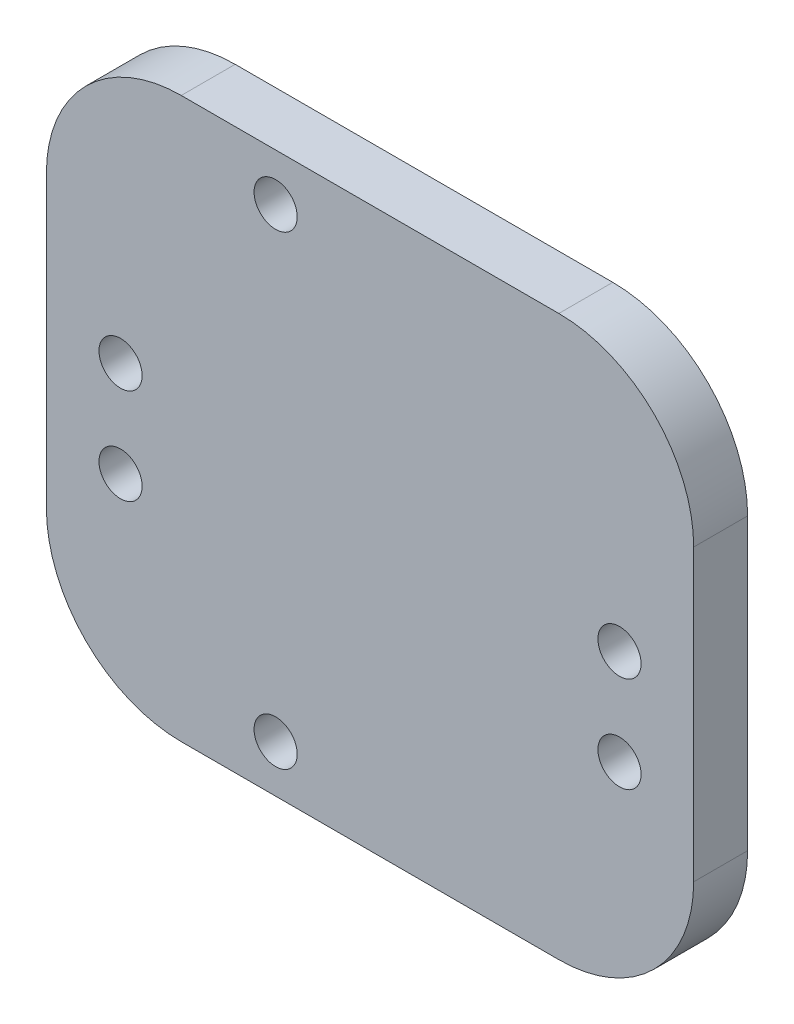
from build123d import *

# Parameters (mm, degrees)
BOSS_EXTRUDE1_DEPTH = 4
CUT_EXTRUDE1_REACH  = 33.978
SKETCH2_R           = 1.6


with BuildPart() as part:
    # Sketch1 → Boss-Extrude1 (new body)
    with BuildSketch(Plane.XY):
        with BuildLine():
            Line((-14, 20.75), (14, 20.75))
            ThreePointArc((14, 20.75), (21.071067812, 17.821067812), (24, 10.75))
            Line((24, 10.75), (24, -10.75))
            ThreePointArc((24, -10.75), (21.071067812, -17.821067812), (14, -20.75))
            Line((14, -20.75), (-14, -20.75))
            ThreePointArc((-14, -20.75), (-21.071067812, -17.821067812), (-24, -10.75))
            Line((-24, -10.75), (-24, 10.75))
            ThreePointArc((-24, 10.75), (-21.071067812, 17.821067812), (-14, 20.75))
        make_face()
    extrude(amount=BOSS_EXTRUDE1_DEPTH)

    # Sketch2 → Cut-Extrude1 (cut, up to next)
    with BuildSketch(Plane.XY, mode=Mode.PRIVATE) as cut_extrude1_sk1:
        with Locations((-7, -17.25)):
            Circle(SKETCH2_R)
    cut_extrude1_tool1 = extrude(cut_extrude1_sk1.sketch, amount=CUT_EXTRUDE1_REACH, mode=Mode.PRIVATE) & part.part
    # Sketch2 → Cut-Extrude1 (cut, up to next)
    with BuildSketch(Plane.XY, mode=Mode.PRIVATE) as cut_extrude1_sk2:
        with Locations((-7, 17.25)):
            Circle(SKETCH2_R)
    cut_extrude1_tool2 = extrude(cut_extrude1_sk2.sketch, amount=CUT_EXTRUDE1_REACH, mode=Mode.PRIVATE) & part.part
    # Sketch2 → Cut-Extrude1 (cut, up to next)
    with BuildSketch(Plane.XY, mode=Mode.PRIVATE) as cut_extrude1_sk3:
        with Locations((18.5, -5.8)):
            Circle(SKETCH2_R)
    cut_extrude1_tool3 = extrude(cut_extrude1_sk3.sketch, amount=CUT_EXTRUDE1_REACH, mode=Mode.PRIVATE) & part.part
    # Sketch2 → Cut-Extrude1 (cut, up to next)
    with BuildSketch(Plane.XY, mode=Mode.PRIVATE) as cut_extrude1_sk4:
        with Locations((18.5, 1.3)):
            Circle(SKETCH2_R)
    cut_extrude1_tool4 = extrude(cut_extrude1_sk4.sketch, amount=CUT_EXTRUDE1_REACH, mode=Mode.PRIVATE) & part.part
    # Sketch2 → Cut-Extrude1 (cut, up to next)
    with BuildSketch(Plane.XY, mode=Mode.PRIVATE) as cut_extrude1_sk5:
        with Locations((-18.5, -5.8)):
            Circle(SKETCH2_R)
    cut_extrude1_tool5 = extrude(cut_extrude1_sk5.sketch, amount=CUT_EXTRUDE1_REACH, mode=Mode.PRIVATE) & part.part
    # Sketch2 → Cut-Extrude1 (cut, up to next)
    with BuildSketch(Plane.XY, mode=Mode.PRIVATE) as cut_extrude1_sk6:
        with Locations((-18.5, 1.3)):
            Circle(SKETCH2_R)
    cut_extrude1_tool6 = extrude(cut_extrude1_sk6.sketch, amount=CUT_EXTRUDE1_REACH, mode=Mode.PRIVATE) & part.part
    add(cut_extrude1_tool1.solids().sort_by_distance((-7, -17.25, 0))[0], mode=Mode.SUBTRACT)
    add(cut_extrude1_tool2.solids().sort_by_distance((-7, 17.25, 0))[0], mode=Mode.SUBTRACT)
    add(cut_extrude1_tool3.solids().sort_by_distance((18.5, -5.8, 0))[0], mode=Mode.SUBTRACT)
    add(cut_extrude1_tool4.solids().sort_by_distance((18.5, 1.3, 0))[0], mode=Mode.SUBTRACT)
    add(cut_extrude1_tool5.solids().sort_by_distance((-18.5, -5.8, 0))[0], mode=Mode.SUBTRACT)
    add(cut_extrude1_tool6.solids().sort_by_distance((-18.5, 1.3, 0))[0], mode=Mode.SUBTRACT)


solid = part.part
